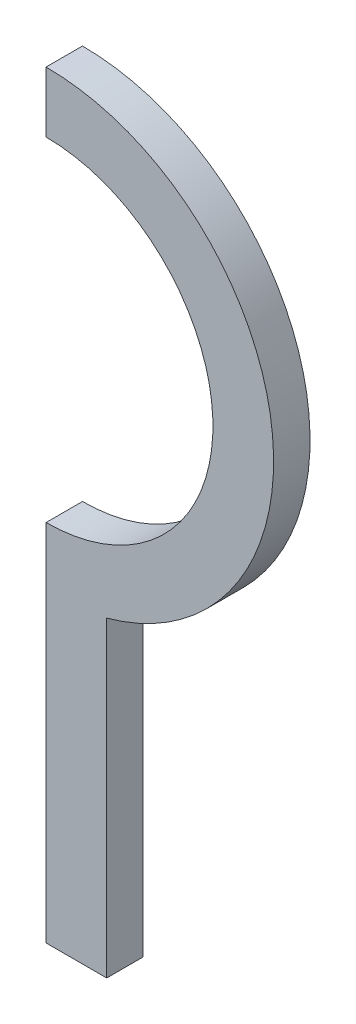
from build123d import *

# Parameters (mm, degrees)
BOSS_EXTRUDE1_DEPTH = 6


with BuildPart() as part:
    # Sketch1 → Boss-Extrude1 (new body)
    with BuildSketch(Plane(origin=(0, 0, 0), x_dir=(0, 1, 0), z_dir=(0, 0, 1))):
        with BuildLine():
            Line((25, -5), (26.357919263, -5))
            ThreePointArc((26.357919263, -5), (67.545888047, -32.158969493), (100, 5))
            Line((100, 5), (90, 5))
            ThreePointArc((90, 5), (62.5, -22.5), (35, 5))
            Line((35, 5), (25, 5))
            Line((25, 5), (-25, 5))
            Line((-25, 5), (-25, -5))
            Line((-25, -5), (25, -5))
        make_face()
    extrude(amount=BOSS_EXTRUDE1_DEPTH)


solid = part.part
